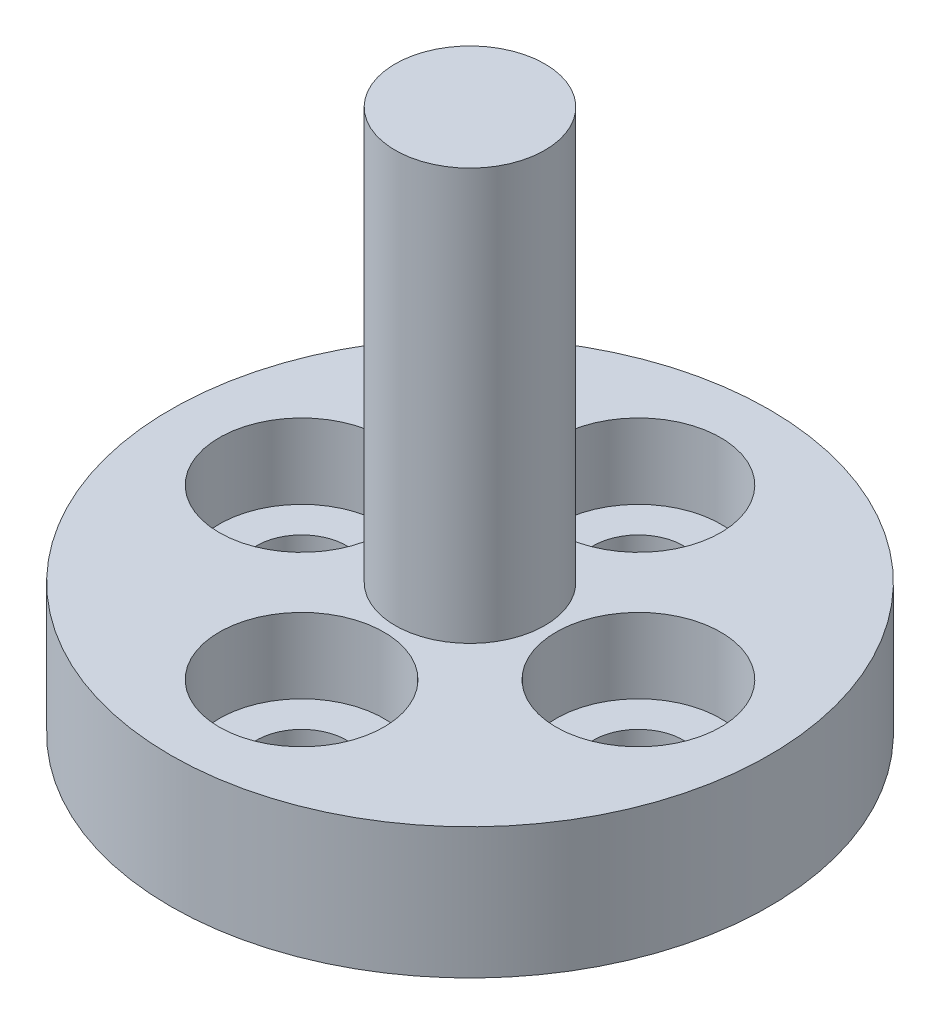
from build123d import *

# Parameters (mm, degrees)
CBORE_FOR_M2_SOCKET_HEAD_CAP_SCREW1_D           = 2.4
CBORE_FOR_M2_SOCKET_HEAD_CAP_SCREW1_DEPTH       = 10.278967257
CBORE_FOR_M2_SOCKET_HEAD_CAP_SCREW1_CBORE_D     = 4.4
CBORE_FOR_M2_SOCKET_HEAD_CAP_SCREW1_CBORE_DEPTH = 2
CBORE_FOR_M2_SOCKET_HEAD_CAP_SCREW1_TIP         = 0.721032743


with BuildPart() as part:
    # Sketch1 → Revolve1 (revolve)
    with BuildSketch(Plane.XY, mode=Mode.PRIVATE) as revolve1_sk:
        Polygon((0, 0), (0, 14.5), (2, 14.5), (2, 3.5), (8, 3.5), (8, 0), align=None)
    revolve(revolve1_sk.sketch.rotate(Axis((0, 0, 0), (0, 1, 0)), 90), axis=Axis((0, 0, 0), (0, 1, 0)))

    # CBORE for M2 Socket Head Cap Screw1
    with Locations(Plane(origin=(0, 3.5, 4.5), x_dir=(0, 0, 1), z_dir=(0, 1, 0))):
        with Locations((0, 0), (-4.5, 4.5), (-9, 0), (-4.5, -4.5)):
            CounterBoreHole(CBORE_FOR_M2_SOCKET_HEAD_CAP_SCREW1_D / 2, CBORE_FOR_M2_SOCKET_HEAD_CAP_SCREW1_CBORE_D / 2, CBORE_FOR_M2_SOCKET_HEAD_CAP_SCREW1_CBORE_DEPTH, depth=CBORE_FOR_M2_SOCKET_HEAD_CAP_SCREW1_DEPTH)
            with Locations((0, 0, -(CBORE_FOR_M2_SOCKET_HEAD_CAP_SCREW1_DEPTH + CBORE_FOR_M2_SOCKET_HEAD_CAP_SCREW1_TIP / 2))):  # 118° drill point
                Cone(0, CBORE_FOR_M2_SOCKET_HEAD_CAP_SCREW1_D / 2, CBORE_FOR_M2_SOCKET_HEAD_CAP_SCREW1_TIP, mode=Mode.SUBTRACT)


solid = part.part
